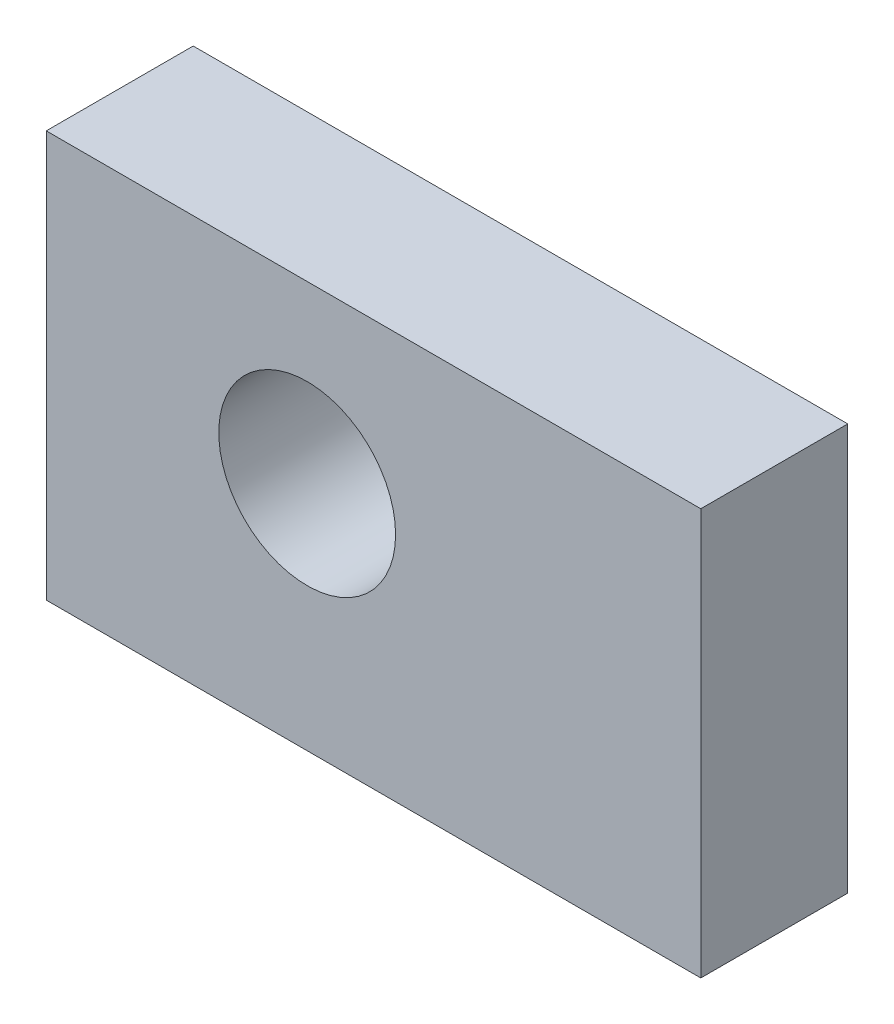
from build123d import *

# Parameters (mm, degrees)
CROQUIS1_W              = 44.539643558
CROQUIS1_H              = 27.654606742
SALIENTE_EXTRUIR1_DEPTH = 10
CROQUIS2_R              = 6.016262627
CORTAR_EXTRUIR1_DEPTH   = 10


with BuildPart() as part:
    # Croquis1 → Saliente-Extruir1 (new body)
    with BuildSketch(Plane.XY):
        with Locations((22.269821779, 13.827303371)):
            Rectangle(CROQUIS1_W, CROQUIS1_H)
    extrude(amount=SALIENTE_EXTRUIR1_DEPTH)

    # Croquis2 → Cortar-Extruir1 (cut)
    with BuildSketch(Plane.XY.offset(10)):
        with Locations((17.755077121, 15.744494071)):
            Circle(CROQUIS2_R)
    extrude(amount=-CORTAR_EXTRUIR1_DEPTH, mode=Mode.SUBTRACT)


solid = part.part
